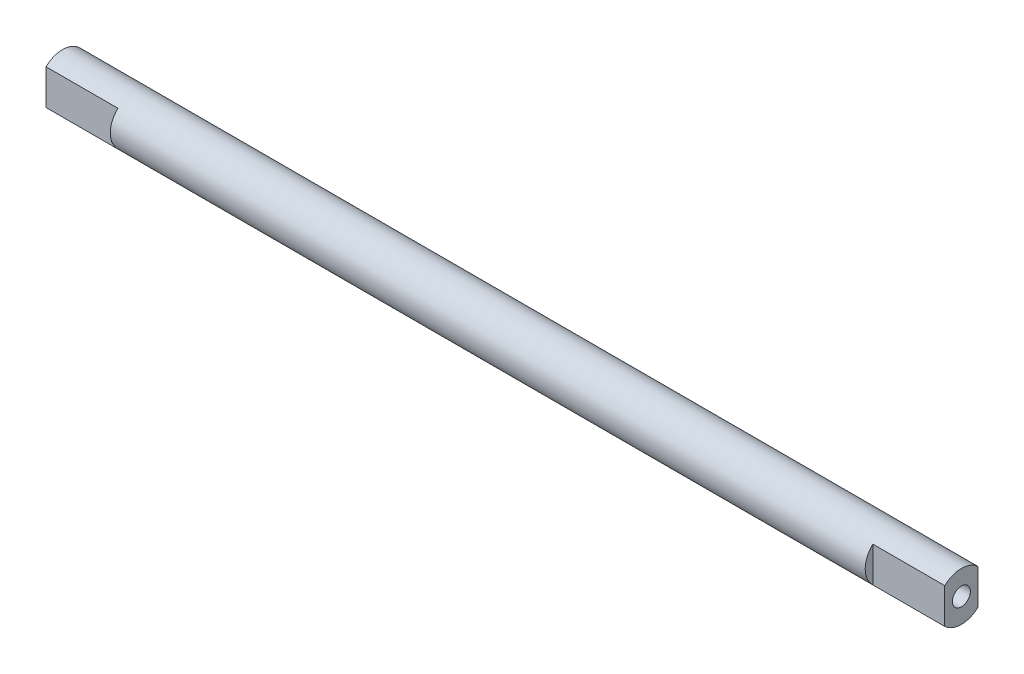
from build123d import *

# Parameters (mm, degrees)
SKETCH1_R           = 2.7
BOSS_EXTRUDE1_DEPTH = 50
CUT_EXTRUDE1_DEPTH  = 8
SKETCH3_R           = 1
CUT_EXTRUDE2_DEPTH  = 6


with BuildPart() as part:
    # Sketch1 → Boss-Extrude1 (new, symmetric)
    with BuildSketch(Plane(origin=(0, 0, 0), x_dir=(0, 0, -1), z_dir=(1, 0, 0))):
        Circle(SKETCH1_R)
    extrude(amount=BOSS_EXTRUDE1_DEPTH, both=True)

    # Sketch2 → Cut-Extrude1 (cut)
    with BuildSketch(Plane(origin=(50, 0, 0), x_dir=(0, 0, -1), z_dir=(1, 0, 0))):
        with BuildLine():
            Line((-1.85, 1.966596044), (-1.85, -1.966596044))
            ThreePointArc((-1.85, -1.966596044), (-2.7, 0), (-1.85, 1.966596044))
        make_face()
        with BuildLine():
            Line((1.85, 1.966596044), (1.85, -1.966596044))
            ThreePointArc((1.85, -1.966596044), (2.7, 0), (1.85, 1.966596044))
        make_face()
    cut_extrude1 = extrude(amount=-CUT_EXTRUDE1_DEPTH, mode=Mode.SUBTRACT)

    # Sketch3 → Cut-Extrude2 (cut)
    with BuildSketch(Plane(origin=(50, 0, 0), x_dir=(0, 0, -1), z_dir=(1, 0, 0))):
        Circle(SKETCH3_R)
    cut_extrude2 = extrude(amount=-CUT_EXTRUDE2_DEPTH, mode=Mode.SUBTRACT)

    # Mirror1: Cut-Extrude1, Cut-Extrude2 across plane
    add(cut_extrude1.mirror(Plane(origin=(0, 0, 0), x_dir=(0, 0, 1), z_dir=(1, 0, 0))), mode=Mode.SUBTRACT)
    add(cut_extrude2.mirror(Plane(origin=(0, 0, 0), x_dir=(0, 0, 1), z_dir=(1, 0, 0))), mode=Mode.SUBTRACT)


solid = part.part
